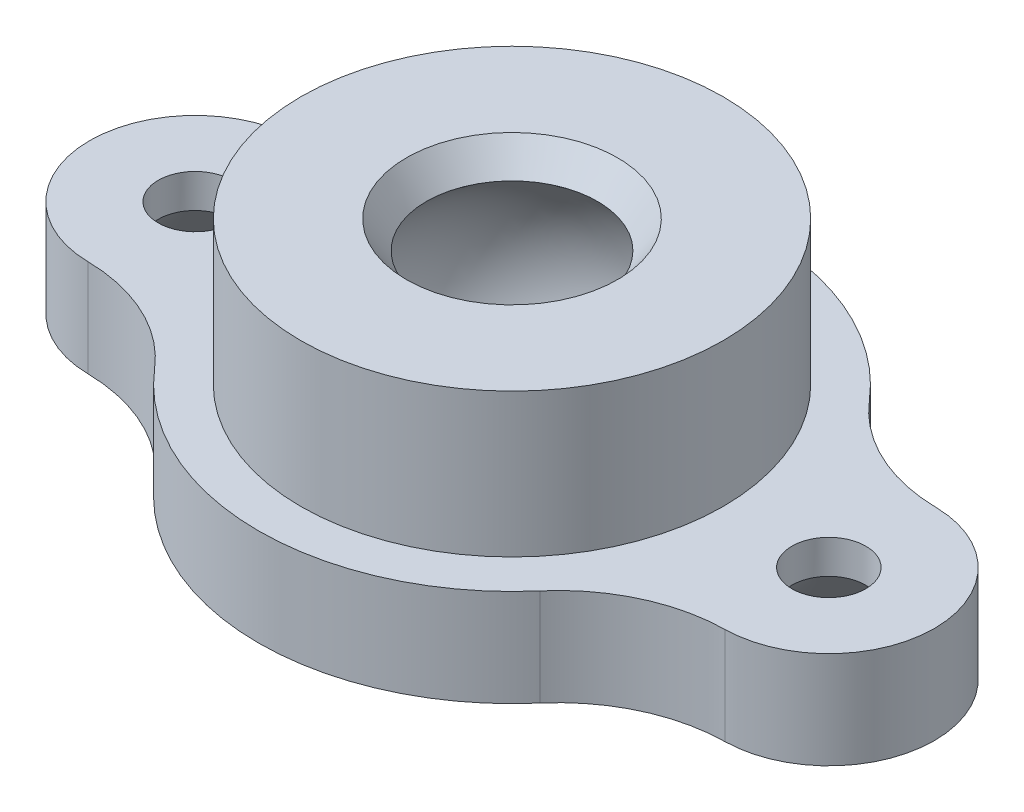
from build123d import *

# Parameters (mm, degrees)
ESQUISSE2_R             = 1.75
ENL_V_MAT_EXTRU_1_DEPTH = 30.090204537
CHANFREIN1_SIZE         = 3
ESQUISSE4_OUTSIDE_W     = 53.542
ESQUISSE4_OUTSIDE_H     = 53.542
ENL_V_MAT_EXTRU_2_DEPTH = 30.090204537


with BuildPart() as part:
    # Esquisse1 → Révolution1 (revolve)
    with BuildSketch(Plane.XY, mode=Mode.PRIVATE) as r_volution1_sk:
        with BuildLine():
            Line((-5.9, -3.577708764), (-7.4209506, -4.5))
            Line((-7.4209506, -4.5), (-20, -4.5))
            Line((-20, -4.5), (-20, 0.1))
            Line((-20, 0.1), (-10, 0.1))
            Line((-10, 0.1), (-10, 6.9))
            Line((-10, 6.9), (-5, 6.9))
            Line((-5, 6.9), (-4.048749214, 5.587273915))
            ThreePointArc((-4.048749214, 5.587273915), (-6.7634037, 1.366151673), (-5.9, -3.577708764))
        make_face()
    revolve(r_volution1_sk.sketch.rotate(Axis((0, 18.9741444, 0), (0, -1, 0)), 270), axis=Axis((0, 18.9741444, 0), (0, -1, 0)))

    # Esquisse2 → Enlèv. mat.-Extru.1 (cut, through all)
    with BuildSketch(Plane(origin=(0, 0.1, 0), x_dir=(1, 0, 0), z_dir=(0, 1, 0))):
        with Locations(Location((-15, 0, 0), (0, 0, 270))):
            Circle(ESQUISSE2_R)
        with Locations(Location((15, 0, 0), (0, 0, 270))):
            Circle(ESQUISSE2_R)
    extrude(amount=-ENL_V_MAT_EXTRU_1_DEPTH, mode=Mode.SUBTRACT)

    # Chanfrein1
    chanfrein1_edges = [part.edges().sort_by_distance(p)[0] for p in [
        (-15, -4.5, -1.75),
        (15, -4.5, -1.75),
    ]]
    chamfer(chanfrein1_edges, length=CHANFREIN1_SIZE)

    # Esquisse4 outside → Enlèv. mat.-Extru.2 (cut, through all)
    with BuildSketch(Plane(origin=(0, 0.1, 0), x_dir=(1, 0, 0), z_dir=(0, 1, 0))):
        Rectangle(ESQUISSE4_OUTSIDE_W, ESQUISSE4_OUTSIDE_H)
        with BuildLine():
            ThreePointArc((-9.12, -7.799076868), (0, -12), (9.12, -7.799076868))
            ThreePointArc((9.12, -7.799076868), (11.797195727, -5.758231957), (15.076923077, -4.999408249))
            ThreePointArc((15.076923077, -4.999408249), (20, 0), (15.076923077, 4.999408249))
            ThreePointArc((15.076923077, 4.999408249), (11.797195727, 5.758231957), (9.12, 7.799076868))
            ThreePointArc((9.12, 7.799076868), (0, 12), (-9.12, 7.799076868))
            ThreePointArc((-9.12, 7.799076868), (-11.797195727, 5.758231957), (-15.076923077, 4.999408249))
            ThreePointArc((-15.076923077, 4.999408249), (-20, 0), (-15.076923077, -4.999408249))
            ThreePointArc((-15.076923077, -4.999408249), (-11.797195727, -5.758231957), (-9.12, -7.799076868))
        make_face(mode=Mode.SUBTRACT)
    extrude(amount=-ENL_V_MAT_EXTRU_2_DEPTH, mode=Mode.SUBTRACT)


solid = part.part
